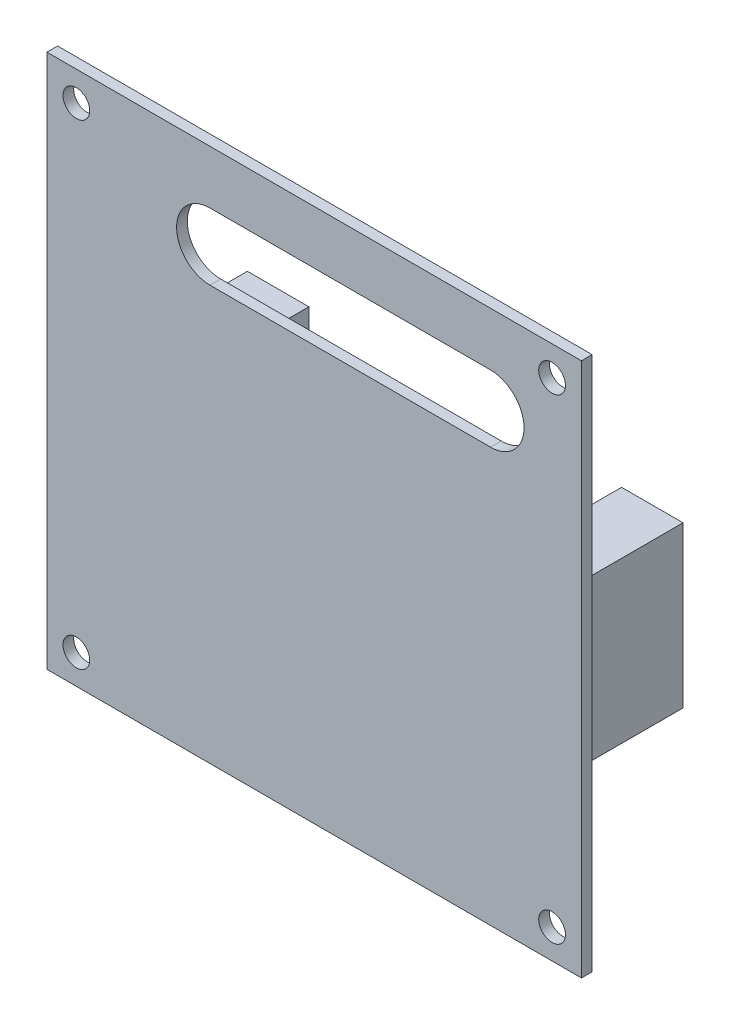
from build123d import *

# Parameters (mm, degrees)
SKETCH1_W           = 40
SKETCH1_H           = 40
SKETCH1_R           = 1
BOSS_EXTRUDE1_DEPTH = 0.8
SKETCH4_W           = 4.6
SKETCH4_H           = 12
BOSS_EXTRUDE2_DEPTH = 12.8
SKETCH5_R           = 0.6
CUT_EXTRUDE1_DEPTH  = 6
CUT_EXTRUDE2_DEPTH  = 6


with BuildPart() as part:
    # Sketch1 → Boss-Extrude1 (new body)
    with BuildSketch(Plane.XY):
        with Locations((0.062552029, -0.069037071)):
            Rectangle(SKETCH1_W, SKETCH1_H)
        with Locations((17.862552029, -17.869037071)):
            Circle(SKETCH1_R, mode=Mode.SUBTRACT)
        with Locations((17.862552029, 17.730962929)):
            Circle(SKETCH1_R, mode=Mode.SUBTRACT)
        with Locations((-17.737447971, 17.730962929)):
            Circle(SKETCH1_R, mode=Mode.SUBTRACT)
        with Locations((-17.737447971, -17.869037071)):
            Circle(SKETCH1_R, mode=Mode.SUBTRACT)
    extrude(amount=BOSS_EXTRUDE1_DEPTH)

    # Sketch4 → Boss-Extrude2 (add)
    with BuildSketch(Plane.XY.offset(0.8)):
        with Locations((12.562552029, -5.569037071)):
            Rectangle(SKETCH4_W, SKETCH4_H)
        with Locations((-15.437447971, -5.569037071)):
            Rectangle(SKETCH4_W, SKETCH4_H)
    extrude(amount=-BOSS_EXTRUDE2_DEPTH)

    # Sketch5 → Cut-Extrude1 (cut)
    with BuildSketch(Plane(origin=(0, 0.430962929, 0), x_dir=(1, 0, 0), z_dir=(0, 1, 0))):
        with Locations(Location((-15.437447971, 6.2, 0), (0, 0, 180))):
            Circle(SKETCH5_R)
        with Locations(Location((12.562552029, 6.2, 0), (0, 0, 180))):
            Circle(SKETCH5_R)
    extrude(amount=-CUT_EXTRUDE1_DEPTH, mode=Mode.SUBTRACT)

    # Sketch6 → Cut-Extrude2 (cut)
    with BuildSketch(Plane(origin=(0, 0, 0), x_dir=(-1, 0, 0), z_dir=(0, 0, -1))):
        with BuildLine():
            Line((7.737447971, 10.930962929), (-13.262552029, 10.930962929))
            ThreePointArc((-13.262552029, 10.930962929), (-15.762552029, 13.430962929), (-13.262552029, 15.930962929))
            Line((-13.262552029, 15.930962929), (7.737447971, 15.930962929))
            ThreePointArc((7.737447971, 15.930962929), (10.237447971, 13.430962929), (7.737447971, 10.930962929))
        make_face()
    extrude(amount=-CUT_EXTRUDE2_DEPTH, mode=Mode.SUBTRACT)


solid = part.part
